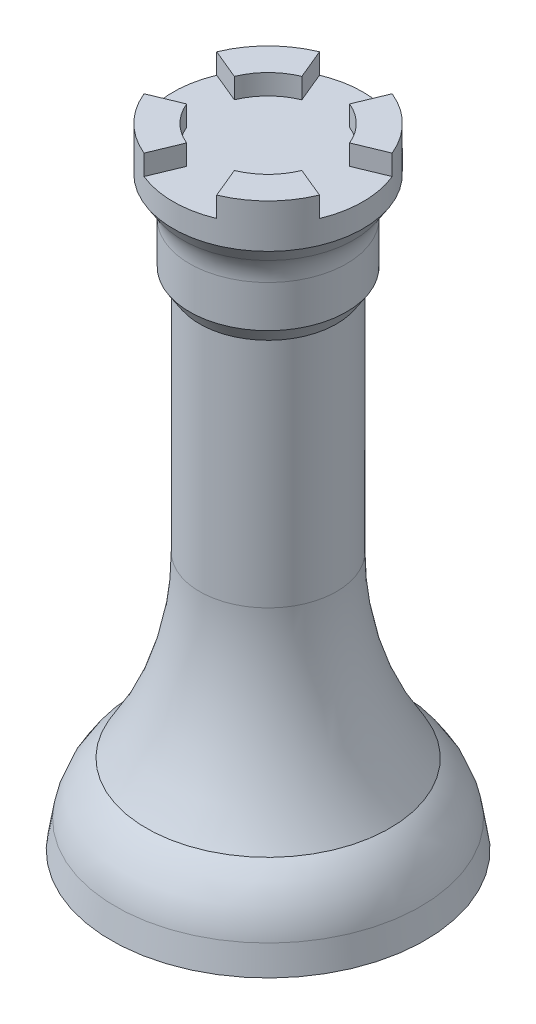
from build123d import *

# Parameters (mm, degrees)
SKETCH1_3_W        = 2.41
SKETCH1_3_H        = 1.5
CUT_REVOLVE1_ANGLE = 45
CIRPATTERN1_COUNT  = 4
CUT_EXTRUDE1_START = -0.4
SKETCH2_R          = 10
CUT_EXTRUDE1_DEPTH = 2


with BuildPart() as part:
    # Sketch1 → Revolve5 (revolve)
    with BuildSketch(Plane.XY):
        with BuildLine():
            Line((-7.010318738, -9.284917782), (4.589681262, -9.284917782))
            Line((4.589681262, -9.284917782), (4.589681262, 35.715082218))
            Line((4.589681262, 35.715082218), (-0.020318738, 35.715082218))
            Line((-0.020318738, 35.715082218), (-0.020318738, 37.215082218))
            Line((-0.020318738, 37.215082218), (-2.430318738, 37.215082218))
            Line((-2.430318738, 37.215082218), (-2.430318738, 33.985082218))
            Line((-2.430318738, 33.985082218), (-1.735040384, 32.910378534))
            ThreePointArc((-1.735040384, 32.910378534), (-1.343438221, 32.058018495), (-1.209241973, 31.129653665))
            Line((-1.209241973, 31.129653665), (-1.209241973, 28.047788417))
            Line((-1.209241973, 28.047788417), (-0.472655293, 26.909233745))
            Line((-0.472655293, 26.909233745), (-0.472655293, 9.778863627))
            ThreePointArc((-0.472655293, 9.778863627), (-1.478108998, 2.901044306), (-4.410318738, -3.401136412))
            ThreePointArc((-4.410318738, -3.401136412), (-5.901404916, -5.134443013), (-6.678030973, -7.284917782))
            Line((-6.678030973, -7.284917782), (-7.010318738, -9.284917782))
        make_face()
    revolve(axis=Axis((4.589681262, -9.284917782, 0), (0, 1, 0)))

    # Sketch1<3> → Cut-Revolve1 (revolve, symmetric, cut)
    with BuildSketch(Plane.XY) as cut_revolve1_sk:
        with Locations((-1.225318738, 36.465082218)):
            Rectangle(SKETCH1_3_W, SKETCH1_3_H)
    cut_revolve1 = revolve(axis=Axis((4.589681262, -9.284917782, 0), (0, 1, 0)), revolution_arc=CUT_REVOLVE1_ANGLE / 2, mode=Mode.SUBTRACT)
    cut_revolve1 = cut_revolve1 + revolve(cut_revolve1_sk.sketch, axis=Axis((4.589681262, -9.284917782, 0), (0, -1, 0)), revolution_arc=CUT_REVOLVE1_ANGLE / 2, mode=Mode.SUBTRACT)

    # CirPattern1: Cut-Revolve1 ×4 about axis
    cirpattern1_axis = Axis((4.589681262, -9.284917782, 0), (0, 1, 0))
    for i in range(1, CIRPATTERN1_COUNT):
        add(cut_revolve1.rotate(cirpattern1_axis, i * 360 / CIRPATTERN1_COUNT), mode=Mode.SUBTRACT)

    # Sketch2 → Cut-Extrude1 (cut)
    with BuildSketch(Plane.XZ.offset(9.284917782).offset(CUT_EXTRUDE1_START)):
        with Locations((4.589681262, 0)):
            Circle(SKETCH2_R)
    extrude(amount=-CUT_EXTRUDE1_DEPTH, mode=Mode.SUBTRACT)


solid = part.part
